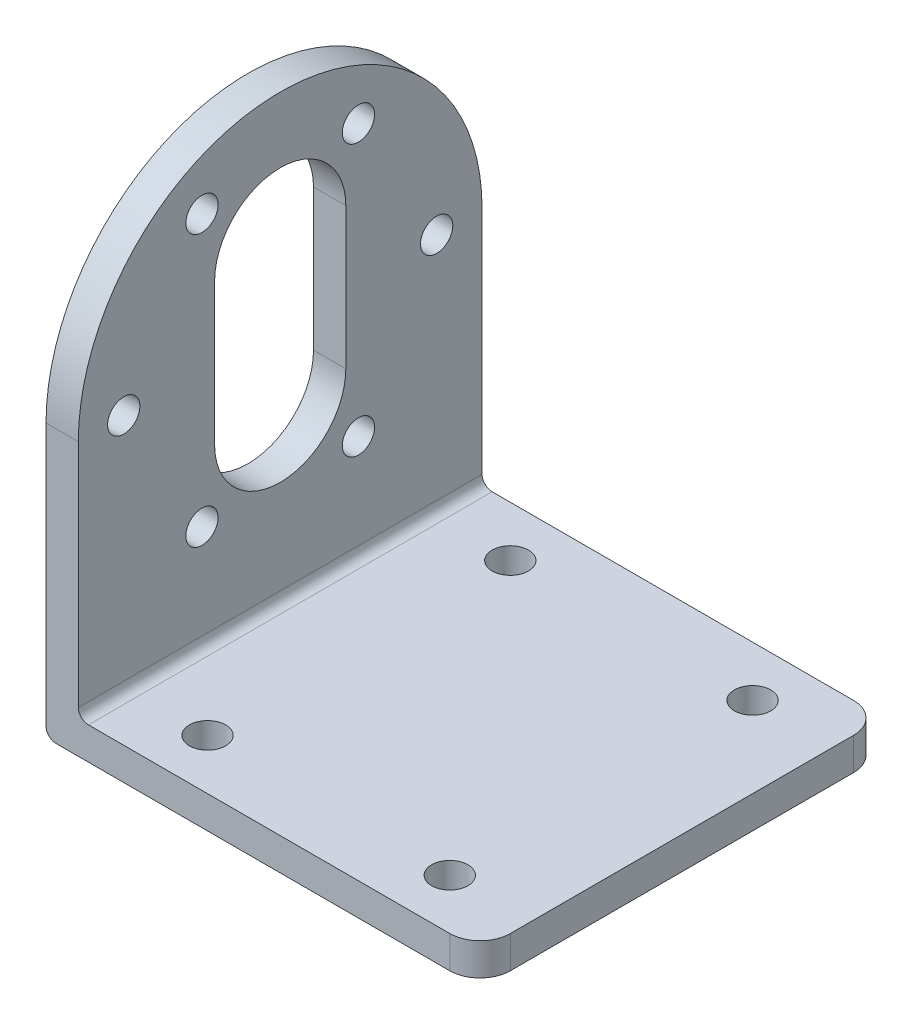
from build123d import *

# Parameters (mm, degrees)
SKETCH_1_W          = 43
SKETCH_1_H          = 40
EXTRUDE_1_DEPTH     = 3.2
SKETCH_2_W          = 3.2
SKETCH_2_H          = 40
EXTRUDE_2_DEPTH     = 23.8
EXTRUDE_3_DEPTH     = 3.2
SKETCH_4_R          = 1.8
CUT_EXTRUDE_1_DEPTH = 53.732248198
FILLET_1_R          = 3
CUT_EXTRUDE_2_REACH = 66.754
SKETCH_5_R          = 1.6
FILLET_2_R          = 1


with BuildPart() as part:
    # 草图1 → 凸台-拉伸1 (new body)
    with BuildSketch(Plane(origin=(0, 0, 0), x_dir=(1, 0, 0), z_dir=(0, 1, 0))):
        Rectangle(SKETCH_1_W, SKETCH_1_H)
    extrude(amount=EXTRUDE_1_DEPTH)

    # 草图2 → 凸台-拉伸2 (add)
    with BuildSketch(Plane(origin=(0, 3.2, 0), x_dir=(1, 0, 0), z_dir=(0, 1, 0))):
        with Locations((-19.9, 0)):
            Rectangle(SKETCH_2_W, SKETCH_2_H)
    extrude(amount=EXTRUDE_2_DEPTH)

    # 草图3 → 凸台-拉伸3 (add)
    with BuildSketch(Plane(origin=(-18.3, 0, 0), x_dir=(0, 0, -1), z_dir=(1, 0, 0))):
        with BuildLine():
            Line((-20, 27), (20, 27))
            ThreePointArc((20, 27), (0, 47), (-20, 27))
        make_face()
    extrude(amount=-EXTRUDE_3_DEPTH)

    # 草图4 → 切除-拉伸1 (cut, through all)
    with BuildSketch(Plane(origin=(0, 3.2, 0), x_dir=(1, 0, 0), z_dir=(0, 1, 0))):
        with Locations(Location((13.5, 15, 0), (0, 0, 270))):
            Circle(SKETCH_4_R)
        with Locations(Location((-10.5, 15, 0), (0, 0, 270))):
            Circle(SKETCH_4_R)
        with Locations(Location((-10.5, -15, 0), (0, 0, 270))):
            Circle(SKETCH_4_R)
        with Locations(Location((13.5, -15, 0), (0, 0, 270))):
            Circle(SKETCH_4_R)
    extrude(amount=-CUT_EXTRUDE_1_DEPTH, mode=Mode.SUBTRACT)

    # 圆角1
    fillet_1_edges = [part.edges().sort_by_distance(p)[0] for p in [
        (21.5, 1.6, 20),
        (21.5, 1.6, -20),
    ]]
    fillet(fillet_1_edges, radius=FILLET_1_R)

    # 草图5 → 切除-拉伸2 (cut, up to next)
    with BuildSketch(Plane(origin=(-18.3, 0, 0), x_dir=(0, 0, -1), z_dir=(1, 0, 0)), mode=Mode.PRIVATE) as cut_extrude_2_sk1:
        with Locations((-7.75, 40.423393759)):
            Circle(SKETCH_5_R)
    cut_extrude_2_tool1 = extrude(cut_extrude_2_sk1.sketch, amount=-CUT_EXTRUDE_2_REACH, mode=Mode.PRIVATE) & part.part
    # 草图5 → 切除-拉伸2 (cut, up to next)
    with BuildSketch(Plane(origin=(-18.3, 0, 0), x_dir=(0, 0, -1), z_dir=(1, 0, 0)), mode=Mode.PRIVATE) as cut_extrude_2_sk2:
        with Locations((7.75, 40.423393759)):
            Circle(SKETCH_5_R)
    cut_extrude_2_tool2 = extrude(cut_extrude_2_sk2.sketch, amount=-CUT_EXTRUDE_2_REACH, mode=Mode.PRIVATE) & part.part
    # 草图5 → 切除-拉伸2 (cut, up to next)
    with BuildSketch(Plane(origin=(-18.3, 0, 0), x_dir=(0, 0, -1), z_dir=(1, 0, 0)), mode=Mode.PRIVATE) as cut_extrude_2_sk3:
        with Locations((15.5, 27)):
            Circle(SKETCH_5_R)
    cut_extrude_2_tool3 = extrude(cut_extrude_2_sk3.sketch, amount=-CUT_EXTRUDE_2_REACH, mode=Mode.PRIVATE) & part.part
    # 草图5 → 切除-拉伸2 (cut, up to next)
    with BuildSketch(Plane(origin=(-18.3, 0, 0), x_dir=(0, 0, -1), z_dir=(1, 0, 0)), mode=Mode.PRIVATE) as cut_extrude_2_sk4:
        with Locations((7.75, 13.576606241)):
            Circle(SKETCH_5_R)
    cut_extrude_2_tool4 = extrude(cut_extrude_2_sk4.sketch, amount=-CUT_EXTRUDE_2_REACH, mode=Mode.PRIVATE) & part.part
    # 草图5 → 切除-拉伸2 (cut, up to next)
    with BuildSketch(Plane(origin=(-18.3, 0, 0), x_dir=(0, 0, -1), z_dir=(1, 0, 0)), mode=Mode.PRIVATE) as cut_extrude_2_sk5:
        with Locations((-7.75, 13.576606241)):
            Circle(SKETCH_5_R)
    cut_extrude_2_tool5 = extrude(cut_extrude_2_sk5.sketch, amount=-CUT_EXTRUDE_2_REACH, mode=Mode.PRIVATE) & part.part
    # 草图5 → 切除-拉伸2 (cut, up to next)
    with BuildSketch(Plane(origin=(-18.3, 0, 0), x_dir=(0, 0, -1), z_dir=(1, 0, 0)), mode=Mode.PRIVATE) as cut_extrude_2_sk6:
        with Locations((-15.5, 27)):
            Circle(SKETCH_5_R)
    cut_extrude_2_tool6 = extrude(cut_extrude_2_sk6.sketch, amount=-CUT_EXTRUDE_2_REACH, mode=Mode.PRIVATE) & part.part
    # 草图5 → 切除-拉伸2 (cut, up to next)
    with BuildSketch(Plane(origin=(-18.3, 0, 0), x_dir=(0, 0, -1), z_dir=(1, 0, 0)), mode=Mode.PRIVATE) as cut_extrude_2_sk7:
        with BuildLine():
            Line((6.5, 34), (6.5, 20))
            ThreePointArc((6.5, 20), (0, 13.5), (-6.5, 20))
            Line((-6.5, 20), (-6.5, 34))
            ThreePointArc((-6.5, 34), (0, 40.5), (6.5, 34))
        make_face()
    cut_extrude_2_tool7 = extrude(cut_extrude_2_sk7.sketch, amount=-CUT_EXTRUDE_2_REACH, mode=Mode.PRIVATE) & part.part
    add(cut_extrude_2_tool1.solids().sort_by_distance((-18.3, 40.423394, 7.75))[0], mode=Mode.SUBTRACT)
    add(cut_extrude_2_tool2.solids().sort_by_distance((-18.3, 40.423394, -7.75))[0], mode=Mode.SUBTRACT)
    add(cut_extrude_2_tool3.solids().sort_by_distance((-18.3, 27, -15.5))[0], mode=Mode.SUBTRACT)
    add(cut_extrude_2_tool4.solids().sort_by_distance((-18.3, 13.576606, -7.75))[0], mode=Mode.SUBTRACT)
    add(cut_extrude_2_tool5.solids().sort_by_distance((-18.3, 13.576606, 7.75))[0], mode=Mode.SUBTRACT)
    add(cut_extrude_2_tool6.solids().sort_by_distance((-18.3, 27, 15.5))[0], mode=Mode.SUBTRACT)
    add(cut_extrude_2_tool7.solids().sort_by_distance((-18.3, 27, 0))[0], mode=Mode.SUBTRACT)

    # 圆角2
    fillet_2_edges = [part.edges().sort_by_distance(p)[0] for p in [
        (-18.3, 3.2, 0),
        (-21.5, 0, 0),
    ]]
    fillet(fillet_2_edges, radius=FILLET_2_R)


solid = part.part
